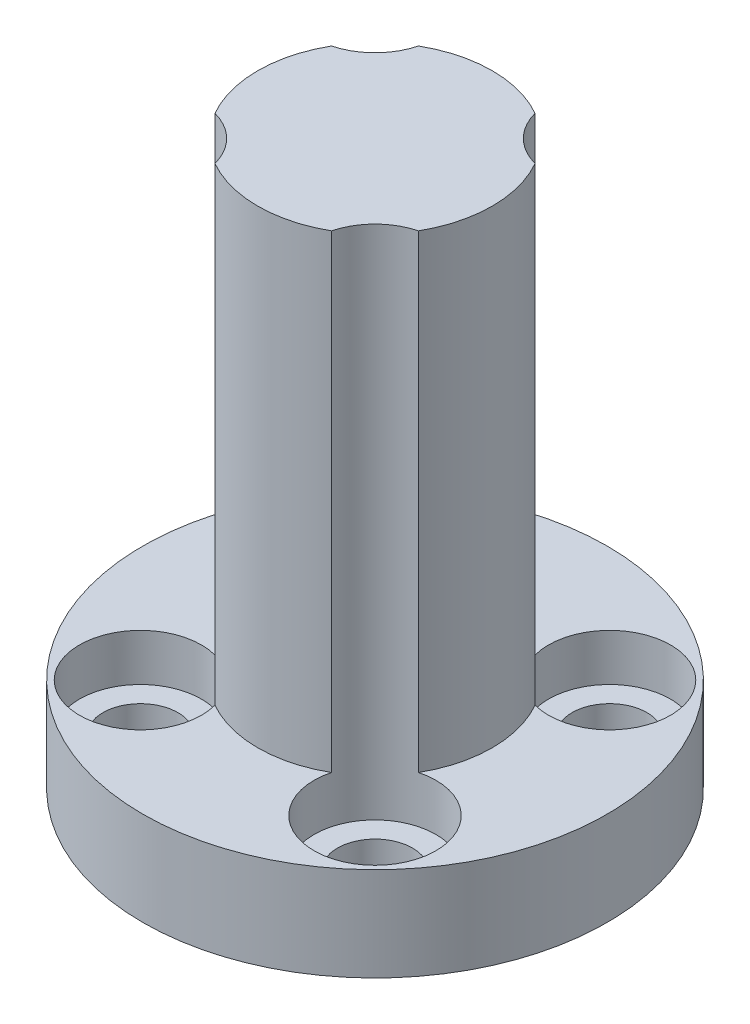
from build123d import *

# Parameters (mm, degrees)
SKETCH1_R           = 9.9
BOSS_EXTRUDE1_DEPTH = 4
SKETCH2_R           = 5
BOSS_EXTRUDE2_DEPTH = 20
CUT_EXTRUDE1_REACH  = 26.414
SKETCH3_R           = 1.6
CUT_EXTRUDE2_REACH  = 26.414
SKETCH3_3_R         = 2.6
SKETCH3_3_R_2       = 1.6
SKETCH3_4_R         = 2.6
SKETCH3_4_R_2       = 1.6
CUT_EXTRUDE3_DEPTH  = 2


with BuildPart() as part:
    # Sketch1 → Boss-Extrude1 (new body)
    with BuildSketch(Plane(origin=(0, 0, 0), x_dir=(1, 0, 0), z_dir=(0, 1, 0))):
        Circle(SKETCH1_R)
    extrude(amount=BOSS_EXTRUDE1_DEPTH)

    # Sketch2 → Boss-Extrude2 (add)
    with BuildSketch(Plane(origin=(0, 4, 0), x_dir=(1, 0, 0), z_dir=(0, 1, 0))):
        Circle(SKETCH2_R)
    extrude(amount=BOSS_EXTRUDE2_DEPTH)

    # Sketch3 → Cut-Extrude1 (cut, up to next)
    with BuildSketch(Plane(origin=(0, 4, 0), x_dir=(1, 0, 0), z_dir=(0, 1, 0)), mode=Mode.PRIVATE) as cut_extrude1_sk1:
        with Locations((-5, 5)):
            Circle(SKETCH3_R)
    cut_extrude1_tool1 = extrude(cut_extrude1_sk1.sketch, amount=-CUT_EXTRUDE1_REACH, mode=Mode.PRIVATE) & part.part
    # Sketch3 → Cut-Extrude1 (cut, up to next)
    with BuildSketch(Plane(origin=(0, 4, 0), x_dir=(1, 0, 0), z_dir=(0, 1, 0)), mode=Mode.PRIVATE) as cut_extrude1_sk2:
        with Locations((5, 5)):
            Circle(SKETCH3_R)
    cut_extrude1_tool2 = extrude(cut_extrude1_sk2.sketch, amount=-CUT_EXTRUDE1_REACH, mode=Mode.PRIVATE) & part.part
    # Sketch3 → Cut-Extrude1 (cut, up to next)
    with BuildSketch(Plane(origin=(0, 4, 0), x_dir=(1, 0, 0), z_dir=(0, 1, 0)), mode=Mode.PRIVATE) as cut_extrude1_sk3:
        with Locations((5, -5)):
            Circle(SKETCH3_R)
    cut_extrude1_tool3 = extrude(cut_extrude1_sk3.sketch, amount=-CUT_EXTRUDE1_REACH, mode=Mode.PRIVATE) & part.part
    # Sketch3 → Cut-Extrude1 (cut, up to next)
    with BuildSketch(Plane(origin=(0, 4, 0), x_dir=(1, 0, 0), z_dir=(0, 1, 0)), mode=Mode.PRIVATE) as cut_extrude1_sk4:
        with Locations((-5, -5)):
            Circle(SKETCH3_R)
    cut_extrude1_tool4 = extrude(cut_extrude1_sk4.sketch, amount=-CUT_EXTRUDE1_REACH, mode=Mode.PRIVATE) & part.part
    add(cut_extrude1_tool1.solids().sort_by_distance((-5, 4, -5))[0], mode=Mode.SUBTRACT)
    add(cut_extrude1_tool2.solids().sort_by_distance((5, 4, -5))[0], mode=Mode.SUBTRACT)
    add(cut_extrude1_tool3.solids().sort_by_distance((5, 4, 5))[0], mode=Mode.SUBTRACT)
    add(cut_extrude1_tool4.solids().sort_by_distance((-5, 4, 5))[0], mode=Mode.SUBTRACT)

    # Sketch3<3> → Cut-Extrude2 (cut, up to next)
    with BuildSketch(Plane(origin=(0, 4, 0), x_dir=(1, 0, 0), z_dir=(0, 1, 0)), mode=Mode.PRIVATE) as cut_extrude2_sk1:
        with Locations((5, 5)):
            Circle(SKETCH3_3_R)
        with Locations((5, 5)):
            Circle(SKETCH3_3_R_2, mode=Mode.SUBTRACT)
    cut_extrude2_tool1 = extrude(cut_extrude2_sk1.sketch, amount=CUT_EXTRUDE2_REACH, mode=Mode.PRIVATE) & part.part
    # Sketch3<3> → Cut-Extrude2 (cut, up to next)
    with BuildSketch(Plane(origin=(0, 4, 0), x_dir=(1, 0, 0), z_dir=(0, 1, 0)), mode=Mode.PRIVATE) as cut_extrude2_sk2:
        with Locations((-5, 5)):
            Circle(SKETCH3_3_R)
        with Locations((-5, 5)):
            Circle(SKETCH3_3_R_2, mode=Mode.SUBTRACT)
    cut_extrude2_tool2 = extrude(cut_extrude2_sk2.sketch, amount=CUT_EXTRUDE2_REACH, mode=Mode.PRIVATE) & part.part
    # Sketch3<3> → Cut-Extrude2 (cut, up to next)
    with BuildSketch(Plane(origin=(0, 4, 0), x_dir=(1, 0, 0), z_dir=(0, 1, 0)), mode=Mode.PRIVATE) as cut_extrude2_sk3:
        with Locations((-5, -5)):
            Circle(SKETCH3_3_R)
        with Locations((-5, -5)):
            Circle(SKETCH3_3_R_2, mode=Mode.SUBTRACT)
    cut_extrude2_tool3 = extrude(cut_extrude2_sk3.sketch, amount=CUT_EXTRUDE2_REACH, mode=Mode.PRIVATE) & part.part
    # Sketch3<3> → Cut-Extrude2 (cut, up to next)
    with BuildSketch(Plane(origin=(0, 4, 0), x_dir=(1, 0, 0), z_dir=(0, 1, 0)), mode=Mode.PRIVATE) as cut_extrude2_sk4:
        with Locations((5, -5)):
            Circle(SKETCH3_3_R)
        with Locations((5, -5)):
            Circle(SKETCH3_3_R_2, mode=Mode.SUBTRACT)
    cut_extrude2_tool4 = extrude(cut_extrude2_sk4.sketch, amount=CUT_EXTRUDE2_REACH, mode=Mode.PRIVATE) & part.part
    add(cut_extrude2_tool1.solids().sort_by_distance((2.473539, 4, -5))[0], mode=Mode.SUBTRACT)
    add(cut_extrude2_tool2.solids().sort_by_distance((-7.526461, 4, -5))[0], mode=Mode.SUBTRACT)
    add(cut_extrude2_tool3.solids().sort_by_distance((-7.526461, 4, 5))[0], mode=Mode.SUBTRACT)
    add(cut_extrude2_tool4.solids().sort_by_distance((2.473539, 4, 5))[0], mode=Mode.SUBTRACT)

    # Sketch3<4> → Cut-Extrude3 (cut)
    # profile 1 of 4: a face of its own
    with BuildSketch(Plane(origin=(0, 4, 0), x_dir=(1, 0, 0), z_dir=(0, 1, 0))):
        with Locations((5, 5)):
            Circle(SKETCH3_4_R)
        with Locations((5, 5)):
            Circle(SKETCH3_4_R_2, mode=Mode.SUBTRACT)
    # profile 2 of 4: a face of its own
    with BuildSketch(Plane(origin=(0, 4, 0), x_dir=(1, 0, 0), z_dir=(0, 1, 0))):
        with Locations((-5, 5)):
            Circle(SKETCH3_4_R)
        with Locations((-5, 5)):
            Circle(SKETCH3_4_R_2, mode=Mode.SUBTRACT)
    # profile 3 of 4: a face of its own
    with BuildSketch(Plane(origin=(0, 4, 0), x_dir=(1, 0, 0), z_dir=(0, 1, 0))):
        with Locations((-5, -5)):
            Circle(SKETCH3_4_R)
        with Locations((-5, -5)):
            Circle(SKETCH3_4_R_2, mode=Mode.SUBTRACT)
    # profile 4 of 4: a face of its own
    with BuildSketch(Plane(origin=(0, 4, 0), x_dir=(1, 0, 0), z_dir=(0, 1, 0))):
        with Locations((5, -5)):
            Circle(SKETCH3_4_R)
        with Locations((5, -5)):
            Circle(SKETCH3_4_R_2, mode=Mode.SUBTRACT)
    extrude(amount=-CUT_EXTRUDE3_DEPTH, mode=Mode.SUBTRACT)


solid = part.part
